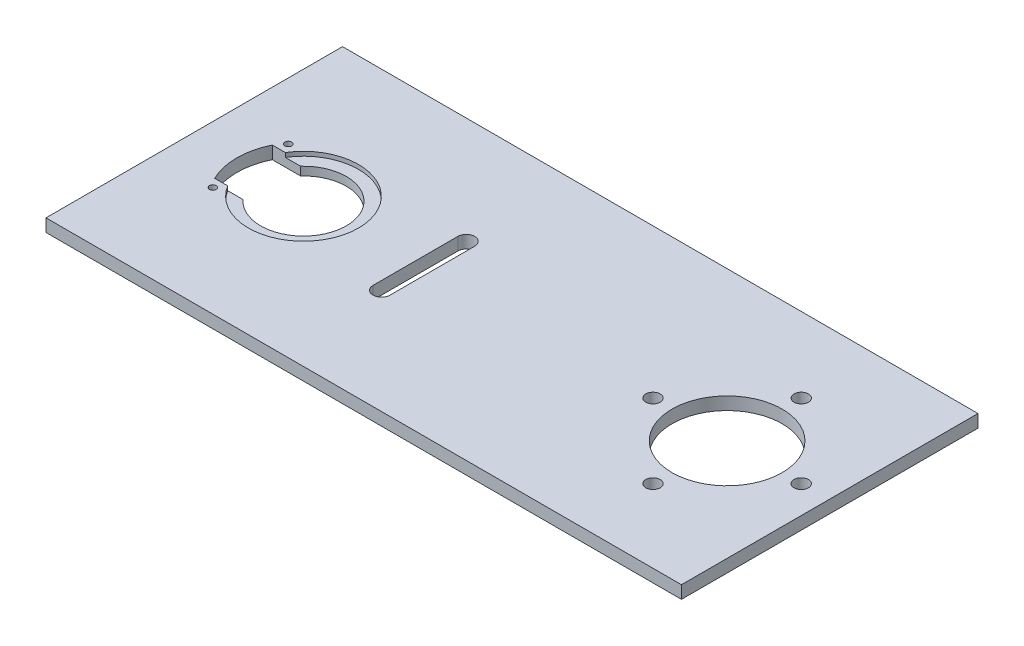
from build123d import *

# Parameters (mm, degrees)
SKETCH1_W                = 150
SKETCH1_H                = 70
BOSS_EXTRUDE1_DEPTH      = 3
SKETCH2_R                = 13
SKETCH2_R_2              = 0.8
CUT_EXTRUDE1_DEPTH       = 166.556636835
SKETCH3_R                = 13
CUT_EXTRUDE2_DEPTH       = 1
M3_CLEARANCE_HOLE1_D     = 3.4
M3_CLEARANCE_HOLE1_DEPTH = 7
M3_CLEARANCE_HOLE1_TIP   = 1.021463052


with BuildPart() as part:
    # Sketch1 → Boss-Extrude1 (new body)
    with BuildSketch(Plane(origin=(0, 0, 0), x_dir=(1, 0, 0), z_dir=(0, 1, 0))):
        with Locations((75, 35)):
            Rectangle(SKETCH1_W, SKETCH1_H)
    extrude(amount=BOSS_EXTRUDE1_DEPTH)

    # Sketch2 → Cut-Extrude1 (cut, through all)
    with BuildSketch(Plane(origin=(0, 3, 0), x_dir=(1, 0, 0), z_dir=(0, 1, 0))):
        with Locations(Location((125.978759571, 34.795735311, 0), (0, 0, 270))):
            Circle(SKETCH2_R)
        with Locations(Location((13.498759571, 43.695735311, 0), (0, 0, 270))):
            Circle(SKETCH2_R_2)
        with Locations(Location((13.498759571, 25.895735311, 0), (0, 0, 90))):
            Circle(SKETCH2_R_2)
        with BuildLine():
            Line((56.404199608, 44.795735311), (56.404199608, 24.795735311))
            ThreePointArc((56.404199608, 24.795735311), (54.404199608, 22.795735311), (52.404199608, 24.795735311))
            Line((52.404199608, 24.795735311), (52.404199608, 44.795735311))
            ThreePointArc((52.404199608, 44.795735311), (54.404199608, 46.795735311), (56.404199608, 44.795735311))
        make_face()
        with BuildLine():
            Line((18.498759571, 41.595735311), (11.828015738, 41.595735311))
            ThreePointArc((11.828015738, 41.595735311), (10.256762989, 34.795735311), (11.828015738, 27.995735311))
            Line((11.828015738, 27.995735311), (18.498759571, 27.995735311))
            ThreePointArc((18.498759571, 27.995735311), (36.08768632, 34.795735311), (18.498759571, 41.595735311))
        make_face()
    extrude(amount=-CUT_EXTRUDE1_DEPTH, mode=Mode.SUBTRACT)

    # Sketch3 → Cut-Extrude2 (cut)
    with BuildSketch(Plane(origin=(0, 3, 0), x_dir=(1, 0, 0), z_dir=(0, 1, 0))):
        with Locations((25.978759571, 34.795735311)):
            Circle(SKETCH3_R)
    extrude(amount=-CUT_EXTRUDE2_DEPTH, mode=Mode.SUBTRACT)

    # M3 Clearance Hole1
    with Locations(Plane(origin=(0, 3, 0), x_dir=(1, 0, 0), z_dir=(0, 1, 0))):
        with Locations((143.478759571, 34.795735311), (125.978759571, 52.295735311), (108.478759571, 34.795735311), (125.978759571, 17.295735311)):
            Hole(M3_CLEARANCE_HOLE1_D / 2, depth=M3_CLEARANCE_HOLE1_DEPTH)
            with Locations((0, 0, -(M3_CLEARANCE_HOLE1_DEPTH + M3_CLEARANCE_HOLE1_TIP / 2))):  # 118° drill point
                Cone(0, M3_CLEARANCE_HOLE1_D / 2, M3_CLEARANCE_HOLE1_TIP, mode=Mode.SUBTRACT)


solid = part.part
